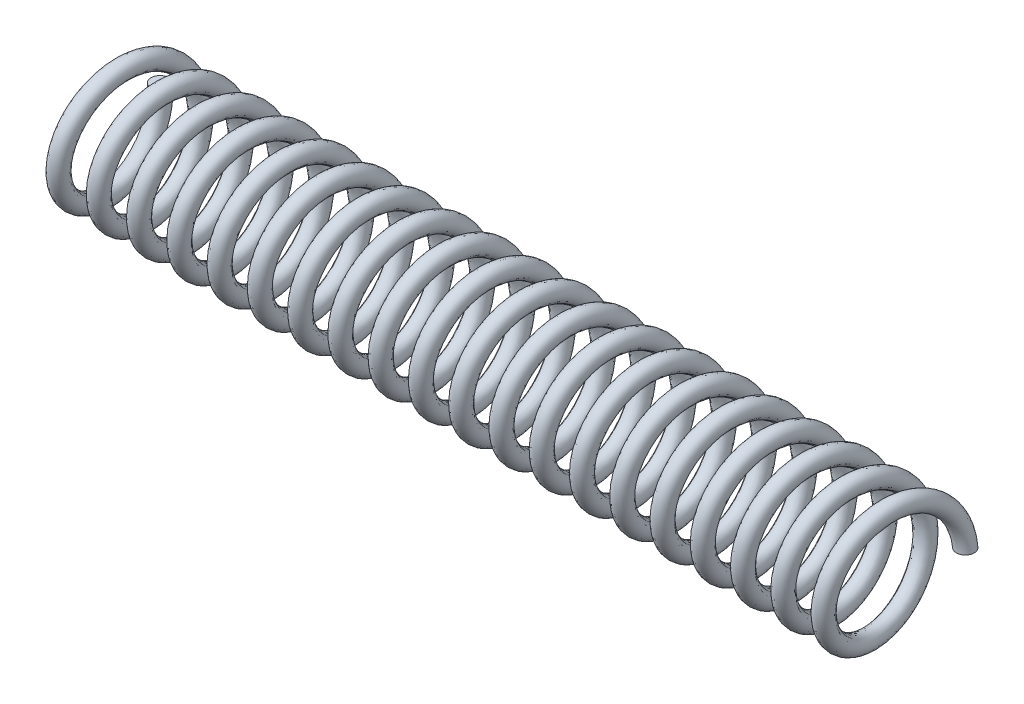
from build123d import *

# Parameters (mm, degrees)
BARRER1_PITCH       = 2.25
BARRER1_HEIGHT      = 45
BARRER1_RADIUS      = 10
BARRER1_START_ANGLE = -180
CROQUIS2_R          = 0.5


with BuildPart() as part:
    # Barrer1: sweep along a helix
    with BuildLine() as barrer1_path:
        add(Helix(BARRER1_PITCH, BARRER1_HEIGHT, BARRER1_RADIUS, center=(0, 0, 0), direction=(1, 0, 0), lefthand=True, mode=Mode.PRIVATE).rotate(Axis((0, 0, 0), (1, 0, 0)), BARRER1_START_ANGLE))
    # Croquis2 → Barrer1 (sweep)
    with BuildSketch(Plane(origin=(0, 0, 0), x_dir=(1, 0, 0), z_dir=(0, 1, 0))):
        with Locations((40.061225237, 3.386742504)):
            Circle(CROQUIS2_R)
    sweep(path=barrer1_path.line, is_frenet=True)


solid = part.part
